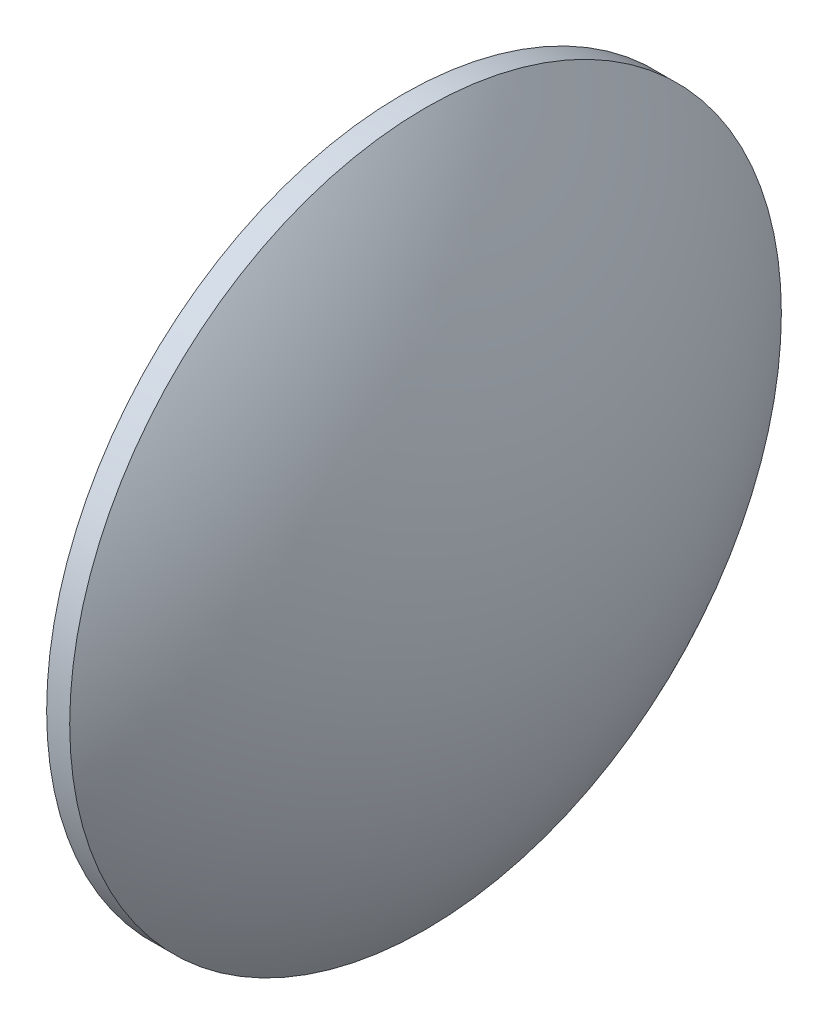
from build123d import *

# Parameters (mm, degrees)
SKETCH1_R           = 30.851139148
BOSS_EXTRUDE1_DEPTH = 2
DOME1_FACE_RADIUS   = 30.851139148
DOME1_HEIGHT        = 10
DOME2_FACE_RADIUS   = 30.851139148
DOME2_HEIGHT        = 10


with BuildPart() as part:
    # Sketch1 → Boss-Extrude1 (new body)
    with BuildSketch(Plane(origin=(0, 0, 0), x_dir=(0, 0, -1), z_dir=(1, 0, 0))):
        Circle(SKETCH1_R)
    extrude(amount=BOSS_EXTRUDE1_DEPTH)

    # Dome1: a dome of height H over a round flat face of radius A is a cap of a sphere of radius (A * A + H * H) / (2 * H)
    dome1_r = (DOME1_FACE_RADIUS * DOME1_FACE_RADIUS + DOME1_HEIGHT * DOME1_HEIGHT) / (2 * DOME1_HEIGHT)
    dome1_base = Plane((2, 0, 0), z_dir=(1, 0, 0))
    with Locations(dome1_base.offset(DOME1_HEIGHT - dome1_r)):
        dome1_ball = Sphere(dome1_r, mode=Mode.PRIVATE)
    add(split(dome1_ball, bisect_by=dome1_base, keep=Keep.TOP, mode=Mode.PRIVATE))

    # Dome2: a dome of height H over a round flat face of radius A is a cap of a sphere of radius (A * A + H * H) / (2 * H)
    dome2_r = (DOME2_FACE_RADIUS * DOME2_FACE_RADIUS + DOME2_HEIGHT * DOME2_HEIGHT) / (2 * DOME2_HEIGHT)
    dome2_base = Plane((0, 0, 0), z_dir=(-1, 0, 0))
    with Locations(dome2_base.offset(DOME2_HEIGHT - dome2_r)):
        dome2_ball = Sphere(dome2_r, mode=Mode.PRIVATE)
    add(split(dome2_ball, bisect_by=dome2_base, keep=Keep.TOP, mode=Mode.PRIVATE))


solid = part.part
